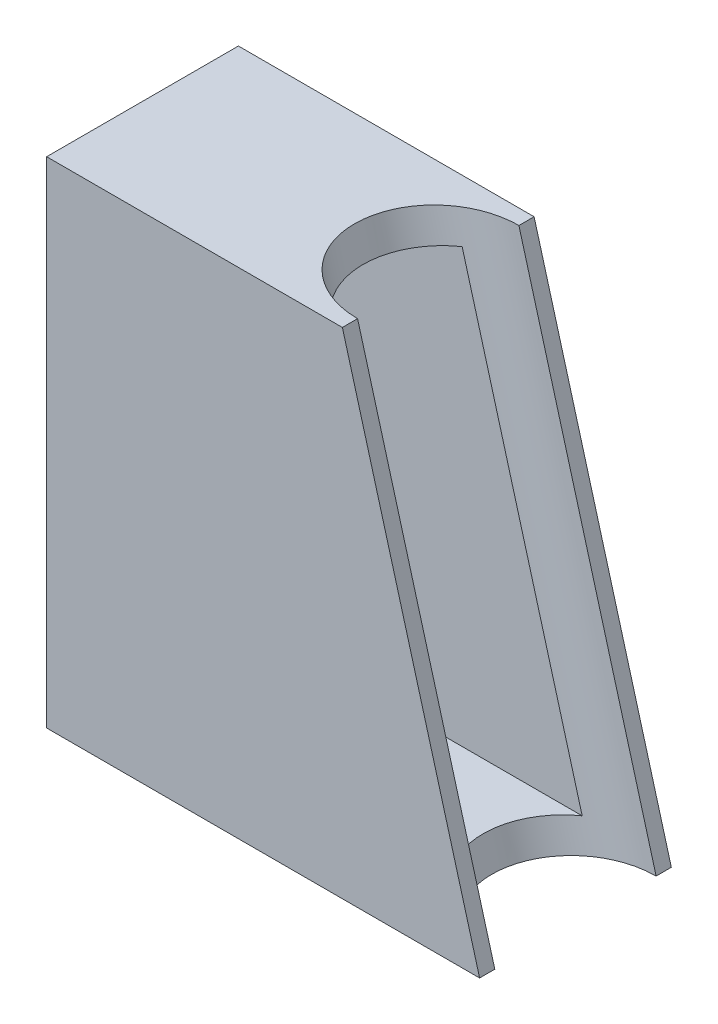
from build123d import *

# Parameters (mm, degrees)
BOSS_EXTRUDE1_DEPTH     = 31
SKETCH5_W               = 21
SKETCH5_H               = 70
CUT_EXTRUDE3_DEPTH      = 110
SKETCH6_R               = 6
CUT_EXTRUDE4_DEPTH      = 110
SKETCH7_W               = 82.876057885
SKETCH7_H               = 21.558852062
CUT_EXTRUDE5_DEPTH      = 110
CUT_EXTRUDE6_DEPTH      = 116.208083877
CUT_EXTRUDE6_DEPTH_BACK = 116.208083877
SKETCH8_R               = 13.04144487


with BuildPart() as part:
    # Sketch1 → Boss-Extrude1 (new body)
    with BuildSketch(Plane.XY):
        Polygon((-75.552372261, 34.084409915), (-75.552372261, -65.915590085), (-5.552372261, -65.915590085), (-33.28739918, 34.084409915), align=None)
    extrude(amount=BOSS_EXTRUDE1_DEPTH)

    # Sketch5 → Cut-Extrude3 (cut)
    with BuildSketch(Plane.ZY.offset(75.552372261)):
        with Locations((15.5, -25.915590085)):
            Rectangle(SKETCH5_W, SKETCH5_H)
    extrude(amount=-CUT_EXTRUDE3_DEPTH, mode=Mode.SUBTRACT)

    # Sketch6 → Cut-Extrude4 (cut)
    with BuildSketch(Plane(origin=(0, -60.915590085, 0), x_dir=(1, 0, 0), z_dir=(0, 1, 0))):
        with Locations(Location((-60.552372261, -14.649638942, 0), (0, 0, 270))):
            Circle(SKETCH6_R)
    extrude(amount=-CUT_EXTRUDE4_DEPTH, mode=Mode.SUBTRACT)

    # Sketch7 → Cut-Extrude5 (cut)
    with BuildSketch(Plane.ZY.offset(75.552372261)):
        with Locations((20.394948081, 24.863835946)):
            Rectangle(SKETCH7_W, SKETCH7_H)
    extrude(amount=-CUT_EXTRUDE5_DEPTH, mode=Mode.SUBTRACT)

    # Sketch8 → Cut-Extrude6 (cut, two sides: drawn at the far end of the back side and taken through both)
    with BuildSketch(Plane(origin=(-5.60875104, 20.222626991, 0), x_dir=(0.9636240692030443, 0.2672613949910582, 0), z_dir=(-0.2672613949910583, 0.9636240692030444, 0)).offset(-CUT_EXTRUDE6_DEPTH_BACK)):
        with Locations((-22.96709211, -15.5)):
            Circle(SKETCH8_R)
    extrude(amount=CUT_EXTRUDE6_DEPTH + CUT_EXTRUDE6_DEPTH_BACK, mode=Mode.SUBTRACT)


solid = part.part
